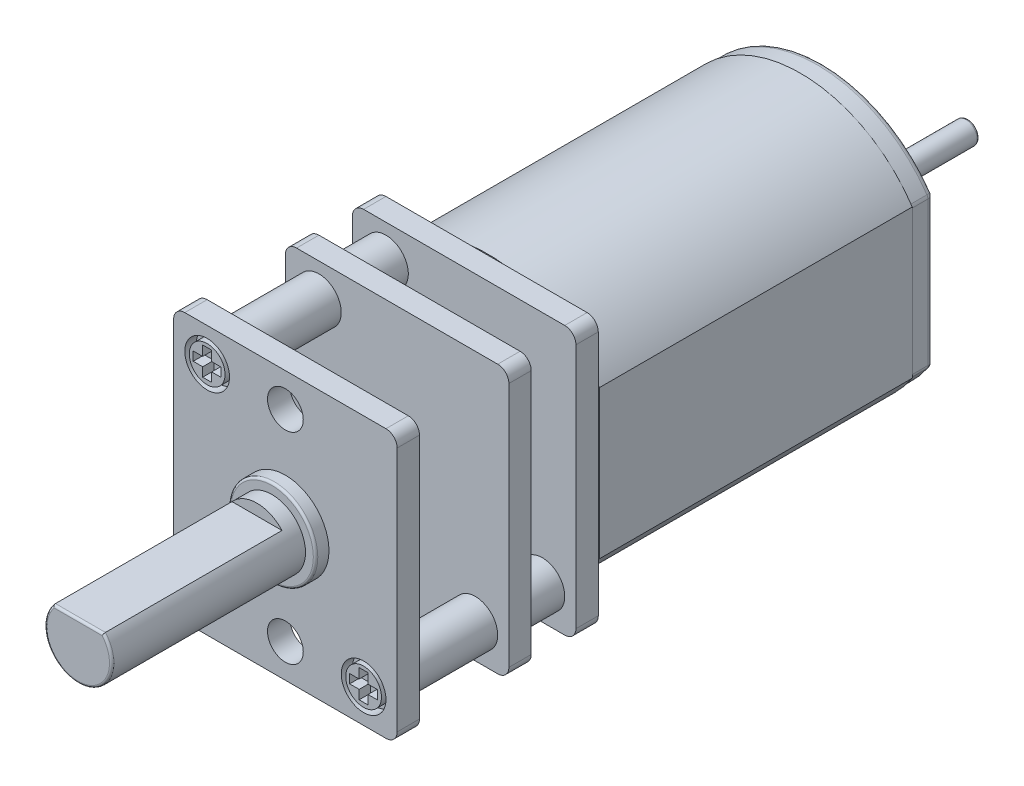
from build123d import *

# Parameters (mm, degrees)
BOSS_EXTRU_1_DEPTH      = 14
BOSS_EXTRU_3_DEPTH      = 1
ESQUISSE4_R             = 2.5
BOSS_EXTRU_4_DEPTH      = 2
ESQUISSE5_R             = 0.5
BOSS_EXTRU_5_DEPTH      = 4.5
ESQUISSE7_W             = 9
ESQUISSE7_H             = 6
BOSS_EXTRU_7_DEPTH      = 0.05
BOSS_EXTRU_8_DEPTH      = 1
ESQUISSE9_R             = 1
BOSS_EXTRU_9_DEPTH      = 2
BOSS_EXTRU_10_DEPTH     = 1
ESQUISSE11_R            = 1
BOSS_EXTRU_11_DEPTH     = 4
BOSS_EXTRU_12_DEPTH     = 1
ESQUISSE13_R            = 0.8
ENL_V_MAT_EXTRU_1_DEPTH = 2
ENL_V_START             = -0.5
ESQUISSE14_R            = 1
ESQUISSE14_R_2          = 0.8
ENL_V_MAT_EXTRU_2_DEPTH = 0.5
ESQUISSE15_R            = 1.95
BOSS_EXTRU_13_DEPTH     = 0.6
ESQUISSE16_R            = 1.5
BOSS_EXTRU_14_DEPTH     = 8.67
ENL_V_START_2           = -8
ENL_V_MAT_EXTRU_3_DEPTH = 8
CONG_1_R                = 0.25
CONG_2_R                = 0.1
CONG_3_R                = 0.1
CONG_4_R                = 0.1
CONG_5_R                = 0.25


with BuildPart() as part:
    # Esquisse1 → Boss.-Extru.1 (new body)
    with BuildSketch(Plane.XY):
        with BuildLine():
            Line((5, 3.31662479), (5, -3.31662479))
            ThreePointArc((5, -3.31662479), (0, -6), (-5, -3.31662479))
            Line((-5, -3.31662479), (-5, 3.31662479))
            ThreePointArc((-5, 3.31662479), (0, 6), (5, 3.31662479))
        make_face()
    extrude(amount=BOSS_EXTRU_1_DEPTH)

    # Esquisse3 → Boss.-Extru.3 (add)
    with BuildSketch(Plane(origin=(0, 0, 0), x_dir=(-1, 0, 0), z_dir=(0, 0, -1))):
        with BuildLine():
            Line((-4.95, 3.301514804), (-4.95, -3.301514804))
            ThreePointArc((-4.95, -3.301514804), (0, -5.95), (4.95, -3.301514804))
            Line((4.95, -3.301514804), (4.95, 3.301514804))
            ThreePointArc((4.95, 3.301514804), (0, 5.95), (-4.95, 3.301514804))
        make_face()
    extrude(amount=BOSS_EXTRU_3_DEPTH)

    # Esquisse4 → Boss.-Extru.4 (add)
    with BuildSketch(Plane(origin=(0, 0, -1), x_dir=(-1, 0, 0), z_dir=(0, 0, -1))):
        with Locations(Location((0, 0, 0), (0, 0, 180))):
            Circle(ESQUISSE4_R)
    extrude(amount=BOSS_EXTRU_4_DEPTH)

    # Esquisse5 → Boss.-Extru.5 (add)
    with BuildSketch(Plane(origin=(0, 0, -3), x_dir=(-1, 0, 0), z_dir=(0, 0, -1))):
        Circle(ESQUISSE5_R)
    extrude(amount=BOSS_EXTRU_5_DEPTH)

    # Esquisse7 → Boss.-Extru.7 (add)
    with BuildSketch(Plane.XY.offset(14)):
        Rectangle(ESQUISSE7_W, ESQUISSE7_H)
    extrude(amount=BOSS_EXTRU_7_DEPTH)

    # Esquisse8 → Boss.-Extru.8 (add)
    with BuildSketch(Plane.XY.offset(14.05)):
        with BuildLine():
            Line((-4.5, 6), (4.5, 6))
            ThreePointArc((4.5, 6), (4.853553391, 5.853553391), (5, 5.5))
            Line((5, 5.5), (5, -5.5))
            ThreePointArc((5, -5.5), (4.853553391, -5.853553391), (4.5, -6))
            Line((4.5, -6), (-4.5, -6))
            ThreePointArc((-4.5, -6), (-4.853553391, -5.853553391), (-5, -5.5))
            Line((-5, -5.5), (-5, 5.5))
            ThreePointArc((-5, 5.5), (-4.853553391, 5.853553391), (-4.5, 6))
        make_face()
    extrude(amount=BOSS_EXTRU_8_DEPTH)

    # Esquisse9 → Boss.-Extru.9 (add)
    with BuildSketch(Plane.XY.offset(15.05)):
        with Locations(Location((-3.5, 4.5, 0), (0, 0, 180))):
            Circle(ESQUISSE9_R)
        with Locations(Location((3.5, -4.5, 0), (0, 0, 180))):
            Circle(ESQUISSE9_R)
    extrude(amount=BOSS_EXTRU_9_DEPTH)

    # Esquisse10 → Boss.-Extru.10 (add)
    with BuildSketch(Plane.XY.offset(17.05)):
        with BuildLine():
            Line((-4.5, 6), (4.5, 6))
            ThreePointArc((4.5, 6), (4.853553391, 5.853553391), (5, 5.5))
            Line((5, 5.5), (5, -5.5))
            ThreePointArc((5, -5.5), (4.853553391, -5.853553391), (4.5, -6))
            Line((4.5, -6), (-4.5, -6))
            ThreePointArc((-4.5, -6), (-4.853553391, -5.853553391), (-5, -5.5))
            Line((-5, -5.5), (-5, 5.5))
            ThreePointArc((-5, 5.5), (-4.853553391, 5.853553391), (-4.5, 6))
        make_face()
    extrude(amount=BOSS_EXTRU_10_DEPTH)

    # Esquisse11 → Boss.-Extru.11 (add)
    with BuildSketch(Plane.XY.offset(18.05)):
        with Locations(Location((-3.5, 4.5, 0), (0, 0, 180))):
            Circle(ESQUISSE11_R)
        with Locations(Location((3.5, -4.5, 0), (0, 0, 180))):
            Circle(ESQUISSE11_R)
    extrude(amount=BOSS_EXTRU_11_DEPTH)

    # Esquisse12 → Boss.-Extru.12 (add)
    with BuildSketch(Plane.XY.offset(22.05)):
        with BuildLine():
            Line((-4.5, 6), (4.5, 6))
            ThreePointArc((4.5, 6), (4.853553391, 5.853553391), (5, 5.5))
            Line((5, 5.5), (5, -5.5))
            ThreePointArc((5, -5.5), (4.853553391, -5.853553391), (4.5, -6))
            Line((4.5, -6), (-4.5, -6))
            ThreePointArc((-4.5, -6), (-4.853553391, -5.853553391), (-5, -5.5))
            Line((-5, -5.5), (-5, 5.5))
            ThreePointArc((-5, 5.5), (-4.853553391, 5.853553391), (-4.5, 6))
        make_face()
    extrude(amount=BOSS_EXTRU_12_DEPTH)

    # Esquisse13 → Enlèv. mat.-Extru.1 (cut)
    with BuildSketch(Plane.XY.offset(23.05)):
        with Locations((0, 4.5)):
            Circle(ESQUISSE13_R)
        with Locations((0, -4.5)):
            Circle(ESQUISSE13_R)
    extrude(amount=-ENL_V_MAT_EXTRU_1_DEPTH, mode=Mode.SUBTRACT)

    # Esquisse14 → Enlèv. mat.-Extru.2 (cut)
    # profile 1 of 4: a face of its own
    with BuildSketch(Plane.XY.offset(23.05).offset(ENL_V_START)):
        with Locations(Location((-3.5, 4.5, 0), (0, 0, 180))):
            Circle(ESQUISSE14_R)
        with Locations((-3.5, 4.5)):
            Circle(ESQUISSE14_R_2, mode=Mode.SUBTRACT)
    # profile 2 of 4: a face of its own
    with BuildSketch(Plane.XY.offset(23.05).offset(ENL_V_START)):
        Polygon((-4.125, 4.3), (-3.7, 4.3), (-3.7, 3.894440891), (-3.3, 3.894440891), (-3.3, 4.3), (-2.875, 4.3), (-2.875, 4.7), (-3.3, 4.7), (-3.3, 5.144440891), (-3.7, 5.144440891), (-3.7, 4.7), (-4.125, 4.7), align=None)
    # profile 3 of 4: a face of its own
    with BuildSketch(Plane.XY.offset(23.05).offset(ENL_V_START)):
        with Locations(Location((3.5, -4.5, 0), (0, 0, 180))):
            Circle(ESQUISSE14_R)
        with Locations((3.5, -4.5)):
            Circle(ESQUISSE14_R_2, mode=Mode.SUBTRACT)
    # profile 4 of 4: a face of its own
    with BuildSketch(Plane.XY.offset(23.05).offset(ENL_V_START)):
        Polygon((3.3, -4.7), (3.3, -5.105559109), (3.7, -5.105559109), (3.7, -4.7), (4.125, -4.7), (4.125, -4.3), (3.7, -4.3), (3.7, -3.855559109), (3.3, -3.855559109), (3.3, -4.3), (2.875, -4.3), (2.875, -4.7), align=None)
    extrude(amount=ENL_V_MAT_EXTRU_2_DEPTH, mode=Mode.SUBTRACT)

    # Esquisse15 → Boss.-Extru.13 (add)
    with BuildSketch(Plane.XY.offset(23.05)):
        Circle(ESQUISSE15_R)
    extrude(amount=BOSS_EXTRU_13_DEPTH)

    # Esquisse16 → Boss.-Extru.14 (add)
    with BuildSketch(Plane.XY.offset(23.65)):
        Circle(ESQUISSE16_R)
    extrude(amount=BOSS_EXTRU_14_DEPTH)

    # Esquisse17 → Enlèv. mat.-Extru.3 (cut)
    with BuildSketch(Plane.XY.offset(32.32).offset(ENL_V_START_2)):
        with BuildLine():
            Line((-1.118033989, 1), (1.118033989, 1))
            ThreePointArc((1.118033989, 1), (0, 1.5), (-1.118033989, 1))
        make_face()
    extrude(amount=ENL_V_MAT_EXTRU_3_DEPTH, mode=Mode.SUBTRACT)

    # Congé1
    cong_1_edges = [part.edges().sort_by_distance(p)[0] for p in [
        (4.95, 3.301514804, -0.5),
        (0, 5.95, -1),
        (4.95, 0, -1),
        (0, -5.95, -1),
        (-4.95, 0, -1),
        (-2.5, 0, -1),
        (-2.5, 0, -3),
    ]]
    fillet(cong_1_edges, radius=CONG_1_R)

    # Congé2
    cong_2_edges = [part.edges().sort_by_distance(p)[0] for p in [
        (0.5, 0, -7.5),
    ]]
    fillet(cong_2_edges, radius=CONG_2_R)

    # Congé3
    cong_3_edges = [part.edges().sort_by_distance(p)[0] for p in [
        (-0.535233135, -1.401258538, 32.32),
        (0, 1, 32.32),
    ]]
    fillet(cong_3_edges, radius=CONG_3_R)

    # Congé4
    cong_4_edges = [part.edges().sort_by_distance(p)[0] for p in [
        (-1.95, 0, 23.65),
    ]]
    fillet(cong_4_edges, radius=CONG_4_R)

    # Congé5
    cong_5_edges = [part.edges().sort_by_distance(p)[0] for p in [
        (-4.95, -3.301514804, -0.375),
        (4.95, -3.301514804, -0.375),
        (-4.95, 3.301514804, -0.375),
        (-4.874755027, 3.278644545, -0.928775503),
        (4.874755027, -3.278644545, -0.928775503),
        (-4.874755027, -3.278644545, -0.928775503),
    ]]
    fillet(cong_5_edges, radius=CONG_5_R)


solid = part.part
